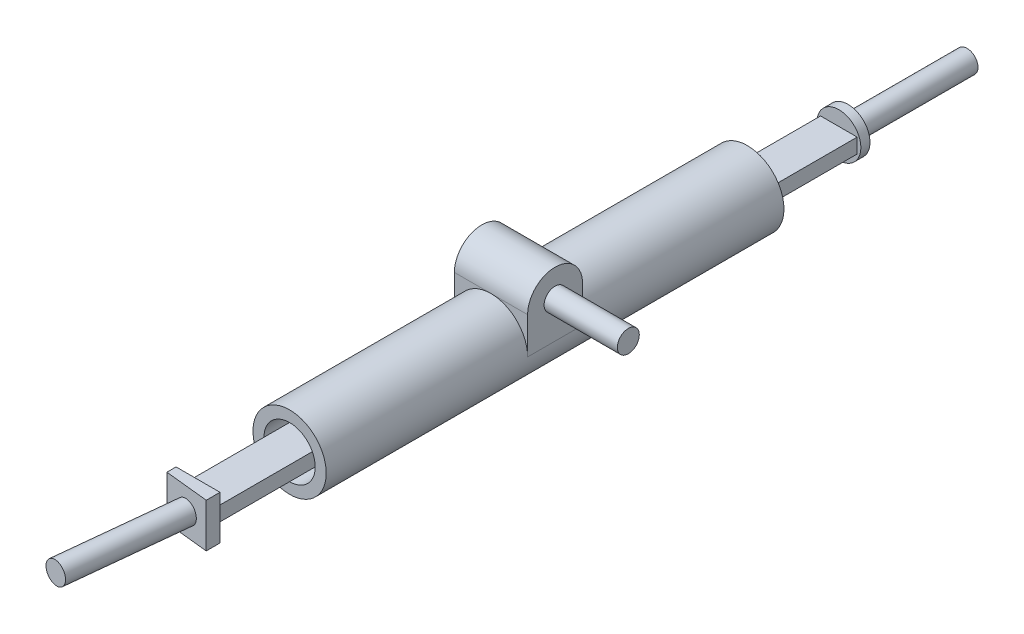
from build123d import *

# Parameters (mm, degrees)
SZKIC1_W                         = 20
SZKIC1_H                         = 8
DODANIE_WYCI_GNI_CIE1_DEPTH      = 350
SZKIC2_R                         = 12
DODANIE_WYCI_GNI_CIE2_DEPTH      = 5
DODANIE_WYCI_GNI_CIE3_START      = 5
SZKIC3_R                         = 12
DODANIE_WYCI_GNI_CIE3_DEPTH      = 5
DODANIE_WYCI_GNI_CIE4_DEPTH      = 8
DODANIE_WYCI_GNI_CIE4_DEPTH_BACK = 16
SZKIC6_R                         = 6
DODANIE_WYCI_GNI_CIE5_DEPTH      = 65
SZKIC7_R                         = 6
DODANIE_WYCI_GNI_CIE6_DEPTH      = 65
SZKIC8_R                         = 20
SZKIC8_R_2                       = 14
DODANIE_WYCI_GNI_CIE7_DEPTH      = 300
SZKIC13_R                        = 20
SZKIC13_R_2                      = 14
WYTNIJ_WYCI_GNI_CIE1_DEPTH       = 50
DODANIE_WYCI_GNI_CIE9_DEPTH      = 20
DODANIE_WYCI_GNI_CIE9_DEPTH_BACK = 20
WYTNIJ_WYCI_GNI_CIE2_DEPTH       = 40
SZKIC16_R                        = 6
DODANIE_WYCI_GNI_CIE10_DEPTH     = 40


with BuildPart() as part:
    # Szkic1 → Dodanie-wyciągnięcie1 (new body)
    with BuildSketch(Plane.XY):
        Rectangle(SZKIC1_W, SZKIC1_H)
    extrude(amount=DODANIE_WYCI_GNI_CIE1_DEPTH)

    # Szkic2 → Dodanie-wyciągnięcie2 (add)
    with BuildSketch(Plane.XY.offset(350)):
        Circle(SZKIC2_R)
    extrude(amount=DODANIE_WYCI_GNI_CIE2_DEPTH)

    # Szkic3 → Dodanie-wyciągnięcie3 (add)
    with BuildSketch(Plane(origin=(0, 0, 0), x_dir=(-1, 0, 0), z_dir=(0, 0, -1)).offset(DODANIE_WYCI_GNI_CIE3_START)):
        with Locations(Location((0, 0, 0), (0, 0, 180))):
            Circle(SZKIC3_R)
    extrude(amount=-DODANIE_WYCI_GNI_CIE3_DEPTH)

    # Szkic5 → Dodanie-wyciągnięcie4 (add, two sides: drawn at the far end of the back side and taken through both)
    with BuildSketch(Plane(origin=(0, 4, 0), x_dir=(1, 0, 0), z_dir=(0, 1, 0)).offset(-DODANIE_WYCI_GNI_CIE4_DEPTH_BACK)):
        Polygon((-12, -350), (12, -350), (12, -357.522501646), (-12, -355), align=None)
    extrude(amount=DODANIE_WYCI_GNI_CIE4_DEPTH + DODANIE_WYCI_GNI_CIE4_DEPTH_BACK)

    # Szkic6 → Dodanie-wyciągnięcie5 (add)
    with BuildSketch(Plane(origin=(-37.035439516, 0, 352.368669275), x_dir=(0.9945218953682733, 0, 0.1045284632676537), z_dir=(-0.1045284632676537, 0, 0.9945218953682733))):
        with Locations(Location((37.23944107, 0, 0), (0, 0, 180))):
            Circle(SZKIC6_R)
    extrude(amount=DODANIE_WYCI_GNI_CIE5_DEPTH)

    # Szkic7 → Dodanie-wyciągnięcie6 (add)
    with BuildSketch(Plane(origin=(0, 0, -5), x_dir=(-1, 0, 0), z_dir=(0, 0, -1))):
        Circle(SZKIC7_R)
    extrude(amount=DODANIE_WYCI_GNI_CIE6_DEPTH)

    # Szkic8 → Dodanie-wyciągnięcie7 (add)
    with BuildSketch(Plane(origin=(0, 0, 350), x_dir=(-1, 0, 0), z_dir=(0, 0, -1))):
        Circle(SZKIC8_R)
        with Locations(Location((0, 0, 0), (0, 0, 148.997280866))):
            Circle(SZKIC8_R_2, mode=Mode.SUBTRACT)
    extrude(amount=DODANIE_WYCI_GNI_CIE7_DEPTH)

    # Szkic13 → Wytnij-wyciągnięcie1 (cut)
    with BuildSketch(Plane.XY.offset(350)):
        Circle(SZKIC13_R)
        Circle(SZKIC13_R_2, mode=Mode.SUBTRACT)
    extrude(amount=-WYTNIJ_WYCI_GNI_CIE1_DEPTH, mode=Mode.SUBTRACT)


with BuildPart() as wytnij_wyci_gni_cie1_piece_1:
    # of the separate pieces the step leaves, piece 1, a body of its own (wytnij_wyci_gni_cie1_pieces)
    add(part.part.solids().sort_by_distance((12, 7.211102551, 300))[0])



with BuildPart() as wytnij_wyci_gni_cie1_piece_2:
    # of the separate pieces the step leaves, piece 2, a body of its own (wytnij_wyci_gni_cie1_pieces)
    add(part.part.solids().sort_by_distance((12, 0, -5))[0])


with BuildPart() as wytnij_wyci_gni_cie1_piece_1_1:
    add(wytnij_wyci_gni_cie1_piece_1.part)

    add(wytnij_wyci_gni_cie1_piece_2.part)  # Dodanie-wyciągnięcie9 merges Wytnij-wyciągnięcie1 piece 2
    # Szkic14 → Dodanie-wyciągnięcie9 (add, two sides: drawn at the far end of the back side and taken through both)
    with BuildSketch(Plane(origin=(0, 0, 0), x_dir=(0, 0, -1), z_dir=(1, 0, 0)).offset(-DODANIE_WYCI_GNI_CIE9_DEPTH_BACK)):
        Polygon((-175, 35), (-160, 35), (-160, 0), (-190, 0), (-190, 35), align=None)
    extrude(amount=DODANIE_WYCI_GNI_CIE9_DEPTH + DODANIE_WYCI_GNI_CIE9_DEPTH_BACK)

    # Szkic15 → Wytnij-wyciągnięcie2 (cut)
    with BuildSketch(Plane(origin=(20, 0, 0), x_dir=(0, 0, -1), z_dir=(1, 0, 0))):
        with BuildLine():
            Line((-190, 35), (-190, 20))
            ThreePointArc((-190, 20), (-185.606601718, 30.606601718), (-175, 35))
            Line((-175, 35), (-190, 35))
        make_face()
        with BuildLine():
            ThreePointArc((-175, 35), (-164.393398282, 30.606601718), (-160, 20))
            Line((-160, 20), (-160, 35))
            Line((-160, 35), (-175, 35))
        make_face()
    extrude(amount=-WYTNIJ_WYCI_GNI_CIE2_DEPTH, mode=Mode.SUBTRACT)

    # Szkic16 → Dodanie-wyciągnięcie10 (add)
    with BuildSketch(Plane(origin=(20, 0, 0), x_dir=(0, 0, -1), z_dir=(1, 0, 0))):
        with Locations(Location((-175, 20, 0), (0, 0, 180))):
            Circle(SZKIC16_R)
    extrude(amount=DODANIE_WYCI_GNI_CIE10_DEPTH)


solid = wytnij_wyci_gni_cie1_piece_1_1.part
